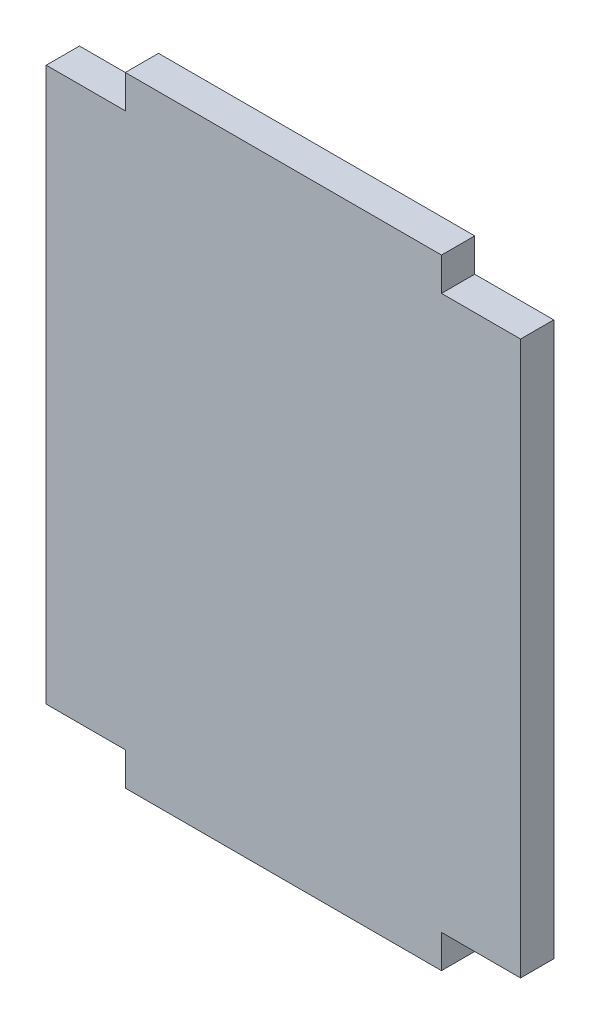
from build123d import *

# Parameters (mm, degrees)
BOSS_EXTRUDE1_DEPTH = 5.334


with BuildPart() as part:
    # Sketch1 → Boss-Extrude1 (new body)
    with BuildSketch(Plane.XY):
        Polygon((0, 0), (50.8, 0), (50.8, -5.334), (63.5, -5.334), (63.5, -94.234), (50.8, -94.234), (50.8, -99.568), (0, -99.568), (0, -94.234), (-12.7, -94.234), (-12.7, -5.334), (0, -5.334), align=None)
    extrude(amount=BOSS_EXTRUDE1_DEPTH)


solid = part.part
